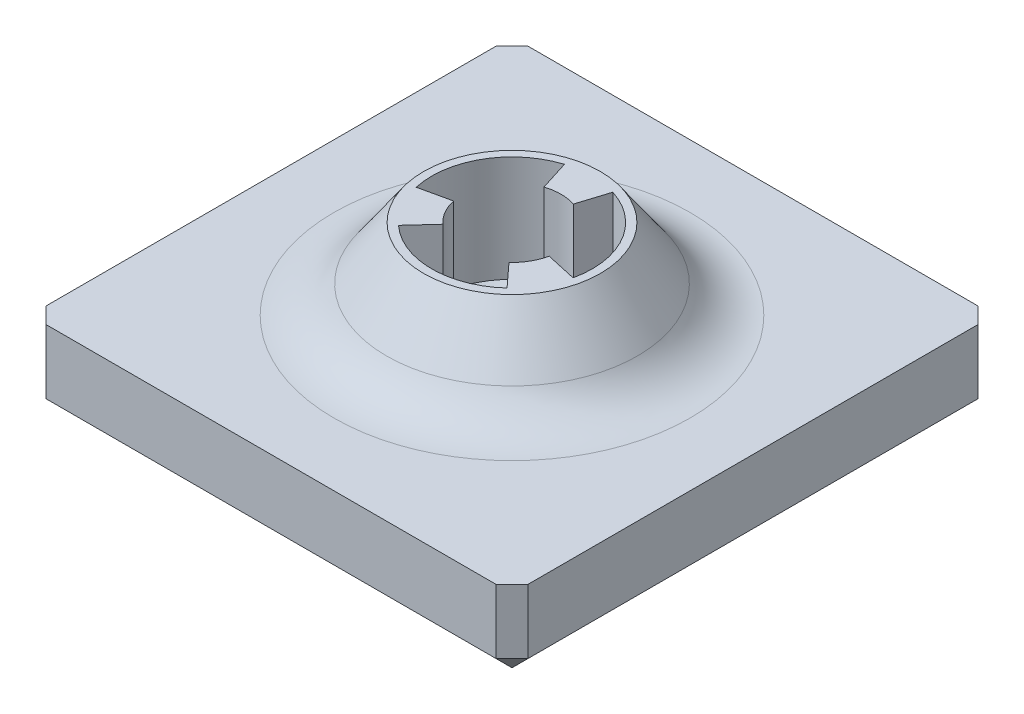
from build123d import *

# Parameters (mm, degrees)
SKETCH1_W           = 30
SKETCH1_H           = 30
BOSS_EXTRUDE1_DEPTH = 5
SKETCH2_R           = 9
BOSS_EXTRUDE2_DEPTH = 5.8
BOSS_EXTRUDE2_TAPER = 35
SKETCH4_R           = 5
CUT_EXTRUDE2_DEPTH  = 8
BOSS_EXTRUDE3_DEPTH = 7.5
CHAMFER1_SIZE       = 1
FILLET2_R           = 4
SKETCH6_W           = 30
SKETCH6_H           = 2
CUT_EXTRUDE3_DEPTH  = 36.210220534
CHAMFER2_SIZE       = 0.6


with BuildPart() as part:
    # Sketch1 → Boss-Extrude1 (new body)
    with BuildSketch(Plane(origin=(0, 0, 0), x_dir=(1, 0, 0), z_dir=(0, 1, 0))):
        Rectangle(SKETCH1_W, SKETCH1_H)
    extrude(amount=BOSS_EXTRUDE1_DEPTH)

    # Sketch2 → Boss-Extrude2 (add)
    with BuildSketch(Plane(origin=(0, 5, 0), x_dir=(1, 0, 0), z_dir=(0, 1, 0))):
        Circle(SKETCH2_R)
    extrude(amount=BOSS_EXTRUDE2_DEPTH, taper=BOSS_EXTRUDE2_TAPER)

    # Sketch4 → Cut-Extrude2 (cut)
    with BuildSketch(Plane(origin=(0, 10.8, 0), x_dir=(1, 0, 0), z_dir=(0, 1, 0))):
        with Locations(Location((0, 0, 0), (0, 0, 270))):
            Circle(SKETCH4_R)
    extrude(amount=-CUT_EXTRUDE2_DEPTH, mode=Mode.SUBTRACT)

    # Sketch5 → Boss-Extrude3 (add)
    with BuildSketch(Plane(origin=(0, 2.8, 0), x_dir=(1, 0, 0), z_dir=(0, 1, 0))):
        with BuildLine():
            Line((-1.533599577, 4.863956449), (-0.917152688, 2.9088367))
            ThreePointArc((-0.917152688, 2.9088367), (0, 3.05), (0.917152688, 2.9088367))
            Line((0.917152688, 2.9088367), (1.533599577, 4.863956449))
            ThreePointArc((1.533599577, 4.863956449), (0, 5.1), (-1.533599577, 4.863956449))
        make_face()
        with BuildLine():
            Line((3.445510059, -3.760114418), (2.060550133, -2.248695877))
            ThreePointArc((2.060550133, -2.248695877), (2.641377482, -1.525), (2.977702822, -0.660140823))
            Line((2.977702822, -0.660140823), (4.979109636, -1.103842031))
            ThreePointArc((4.979109636, -1.103842031), (4.416729559, -2.55), (3.445510059, -3.760114418))
        make_face()
        with BuildLine():
            Line((-4.979109636, -1.103842031), (-2.977702822, -0.660140823))
            ThreePointArc((-2.977702822, -0.660140823), (-2.641377482, -1.525), (-2.060550133, -2.248695877))
            Line((-2.060550133, -2.248695877), (-3.445510059, -3.760114418))
            ThreePointArc((-3.445510059, -3.760114418), (-4.416729559, -2.55), (-4.979109636, -1.103842031))
        make_face()
    extrude(amount=BOSS_EXTRUDE3_DEPTH)

    # Chamfer1
    chamfer1_edges = [part.edges().sort_by_distance(p)[0] for p in [
        (0, 0, 15),
        (-15, 0, 0),
        (0, 0, -15),
        (15, 0, 0),
        (15, 2.5, 15),
        (-15, 2.5, 15),
        (-15, 2.5, -15),
        (15, 2.5, -15),
    ]]
    chamfer(chamfer1_edges, length=CHAMFER1_SIZE)

    # Fillet2
    fillet2_edges = [part.edges().sort_by_distance(p)[0] for p in [
        (-9, 5, 0),
    ]]
    fillet(fillet2_edges, radius=FILLET2_R)

    # Sketch6 → Cut-Extrude3 (cut, through all)
    with BuildSketch(Plane.XY.offset(15)):
        with Locations((0, 11)):
            Rectangle(SKETCH6_W, SKETCH6_H)
    extrude(amount=-CUT_EXTRUDE3_DEPTH, mode=Mode.SUBTRACT)

    # Chamfer2
    chamfer2_edges = [part.edges().sort_by_distance(p)[0] for p in [
        (-4.330127019, 2.8, -2.5),
        (-1.210340843, 2.8, -3.838710727),
        (1.210340843, 2.8, -3.838710727),
        (0, 2.8, -3.05),
        (4.330127019, 2.8, -2.5),
        (3.929591429, 2.8, 0.871169446),
        (2.719250586, 2.8, 2.967541281),
        (2.641377482, 2.8, 1.525),
        (0, 2.8, 5),
        (-2.719250586, 2.8, 2.967541281),
        (-3.929591429, 2.8, 0.871169446),
        (-2.641377482, 2.8, 1.525),
    ]]
    chamfer(chamfer2_edges, length=CHAMFER2_SIZE)


solid = part.part
